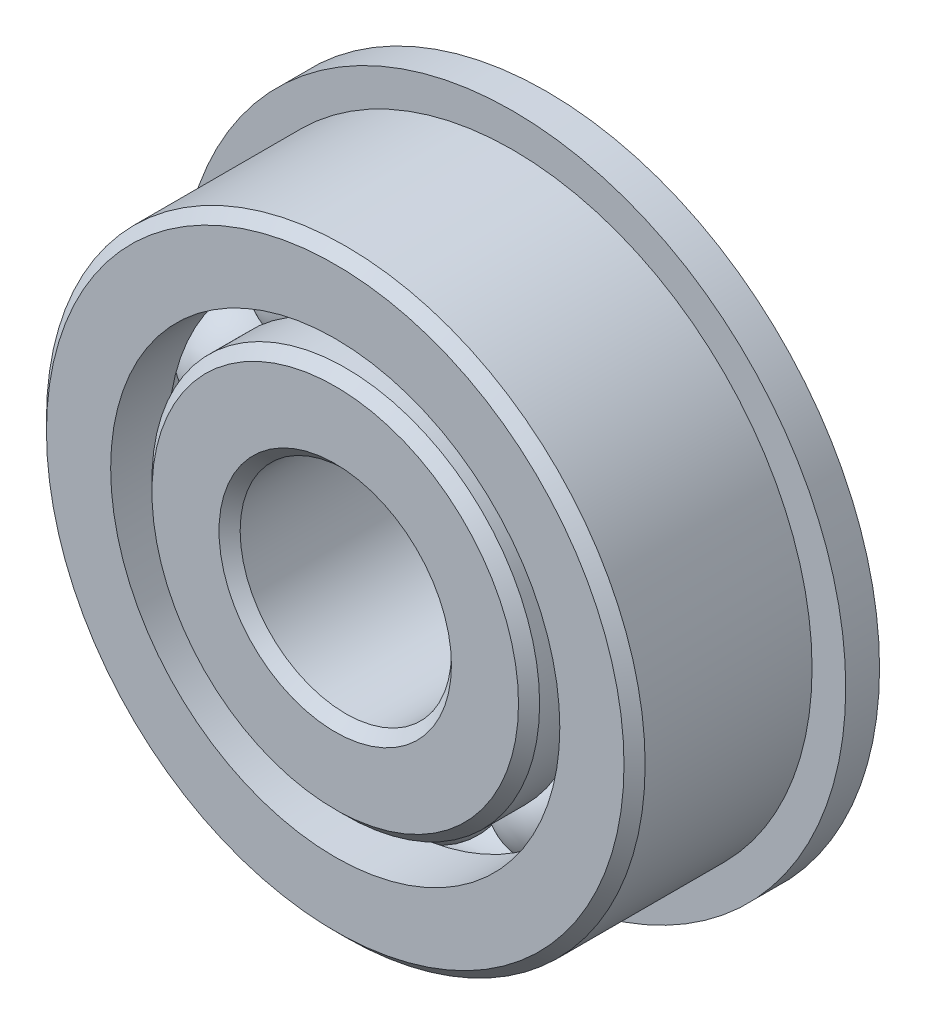
from build123d import *

# Parameters (mm, degrees)
SKETCH6_W         = 1.524
SKETCH6_H         = 4.8879125
CIRPATTERN1_COUNT = 10


with BuildPart() as part:
    # Sketch1 → Revolve1 (revolve)
    with BuildSketch(Plane(origin=(0, 0, 0), x_dir=(0, 0, -1), z_dir=(1, 0, 0))):
        with BuildLine():
            Line((4.28625, 13.49375), (-4.28625, 13.49375))
            Line((-4.28625, 13.49375), (-4.7625, 13.0175))
            Line((-4.7625, 13.0175), (-4.7625, 10.1234875))
            Line((-4.7625, 10.1234875), (-2.163239482, 10.1234875))
            ThreePointArc((-2.163239482, 10.1234875), (0, 11.509375), (2.163239482, 10.1234875))
            Line((2.163239482, 10.1234875), (4.7625, 10.1234875))
            Line((4.7625, 10.1234875), (4.7625, 13.0175))
            Line((4.7625, 13.0175), (4.28625, 13.49375))
        make_face()
    revolve(axis=Axis((0, 0, 4.7625), (0, 0, -1)))

    # Sketch6 → Revolve6 (revolve)
    with BuildSketch(Plane(origin=(0, 0, 0), x_dir=(0, 0, -1), z_dir=(1, 0, 0))):
        with Locations((4.0005, 12.56744375)):
            Rectangle(SKETCH6_W, SKETCH6_H)
    revolve(axis=Axis((0, 0, -4.7625), (0, 0, 1)))


with BuildPart() as body_2:
    # Sketch3 → Revolve3 (revolve)
    with BuildSketch(Plane(origin=(0, 0, 0), x_dir=(0, 0, -1), z_dir=(1, 0, 0))):
        with BuildLine():
            Line((-4.7625, 5.23875), (-4.7625, 8.26135))
            Line((-4.7625, 8.26135), (-4.28625, 8.7376))
            Line((-4.28625, 8.7376), (-2.349008682, 8.7376))
            ThreePointArc((-2.349008682, 8.7376), (0, 6.746875), (2.349008682, 8.7376))
            Line((2.349008682, 8.7376), (5.88645, 8.7376))
            Line((5.88645, 8.7376), (6.3627, 8.26135))
            Line((6.3627, 8.26135), (6.3627, 5.23875))
            Line((6.3627, 5.23875), (5.88645, 4.7625))
            Line((5.88645, 4.7625), (-4.28625, 4.7625))
            Line((-4.28625, 4.7625), (-4.7625, 5.23875))
        make_face()
    revolve(axis=Axis((0, 0, 4.7625), (0, 0, -1)))


with BuildPart() as body_3:
    # Sketch4 → Revolve4 (revolve)
    with BuildSketch(Plane(origin=(0, 0, 0), x_dir=(0, 0, -1), z_dir=(1, 0, 0))):
        with BuildLine():
            Line((-2.38125, 9.128125), (2.38125, 9.128125))
            ThreePointArc((2.38125, 9.128125), (0, 11.509375), (-2.38125, 9.128125))
        make_face()
    revolve(axis=Axis((0, 9.128125, 2.38125), (0, 0, -1)))


with BuildPart() as cirpattern1_1:
    # CirPattern1: pattern copy
    add(body_3.part.rotate(Axis((0, 0, -4.7625), (0, 0, 1)), 1 * 360 / CIRPATTERN1_COUNT))


with BuildPart() as cirpattern1_2:
    # CirPattern1: pattern copy
    add(body_3.part.rotate(Axis((0, 0, -4.7625), (0, 0, 1)), 2 * 360 / CIRPATTERN1_COUNT))


with BuildPart() as cirpattern1_3:
    # CirPattern1: pattern copy
    add(body_3.part.rotate(Axis((0, 0, -4.7625), (0, 0, 1)), 3 * 360 / CIRPATTERN1_COUNT))


with BuildPart() as cirpattern1_4:
    # CirPattern1: pattern copy
    add(body_3.part.rotate(Axis((0, 0, -4.7625), (0, 0, 1)), 4 * 360 / CIRPATTERN1_COUNT))


with BuildPart() as cirpattern1_5:
    # CirPattern1: pattern copy
    add(body_3.part.rotate(Axis((0, 0, -4.7625), (0, 0, 1)), 5 * 360 / CIRPATTERN1_COUNT))


with BuildPart() as cirpattern1_6:
    # CirPattern1: pattern copy
    add(body_3.part.rotate(Axis((0, 0, -4.7625), (0, 0, 1)), 6 * 360 / CIRPATTERN1_COUNT))


with BuildPart() as cirpattern1_7:
    # CirPattern1: pattern copy
    add(body_3.part.rotate(Axis((0, 0, -4.7625), (0, 0, 1)), 7 * 360 / CIRPATTERN1_COUNT))


with BuildPart() as cirpattern1_8:
    # CirPattern1: pattern copy
    add(body_3.part.rotate(Axis((0, 0, -4.7625), (0, 0, 1)), 8 * 360 / CIRPATTERN1_COUNT))


with BuildPart() as cirpattern1_9:
    # CirPattern1: pattern copy
    add(body_3.part.rotate(Axis((0, 0, -4.7625), (0, 0, 1)), 9 * 360 / CIRPATTERN1_COUNT))


solid = Compound([part.part, body_2.part, body_3.part, cirpattern1_1.part, cirpattern1_2.part, cirpattern1_3.part, cirpattern1_4.part, cirpattern1_5.part, cirpattern1_6.part, cirpattern1_7.part, cirpattern1_8.part, cirpattern1_9.part])
